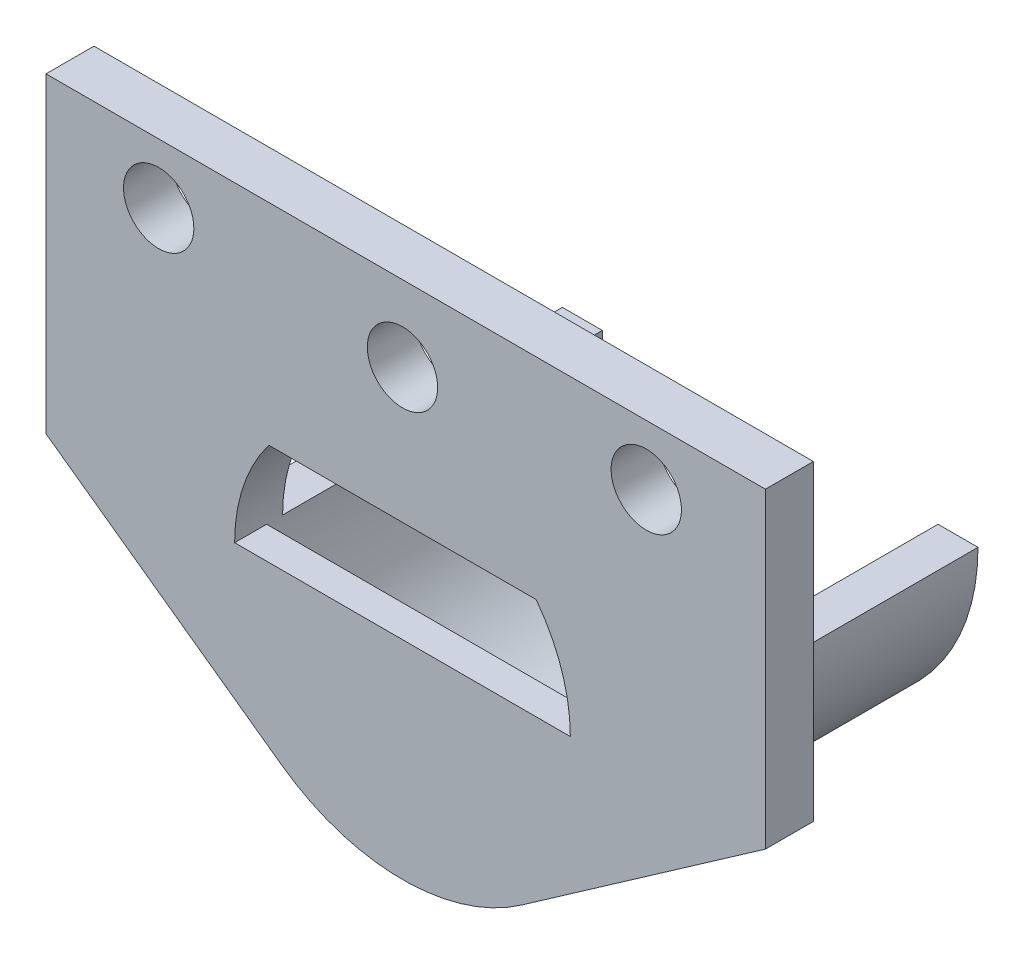
from build123d import *

# Parameters (mm, degrees)
SKETCH_2_R      = 10.5
SKETCH_2_R_2    = 2.2
EXTRUDE_1_DEPTH = 3
EXTRUDE_START   = -2
EXTRUDE_3_DEPTH = 2
EXTRUDE_START_2 = 20
EXTRUDE_5_DEPTH = 20


with BuildPart() as part:
    # 草图2 → 凸台-拉伸1 (new body)
    with BuildSketch(Plane.XY):
        with BuildLine():
            Line((8214.670798087, 3013.113410171), (8259.670798087, 3013.113410171))
            Line((8259.670798087, 3013.113410171), (8259.670798087, 2993.613410171))
            Line((8259.670798087, 2993.613410171), (8244.413270011, 2982.956276447))
            ThreePointArc((8244.413270011, 2982.956276447), (8236.88707696, 2980.614241973), (8229.391164024, 2983.051452794))
            Line((8229.391164024, 2983.051452794), (8214.670798087, 2993.613410171))
            Line((8214.670798087, 2993.613410171), (8214.670798087, 3013.113410171))
        make_face()
        with Locations((8236.969436473, 2993.613410171)):
            Circle(SKETCH_2_R, mode=Mode.SUBTRACT)
        with Locations((8236.969436473, 3008.366275847)):
            Circle(SKETCH_2_R_2, mode=Mode.SUBTRACT)
        with Locations((8221.719436473, 3009.366275847)):
            Circle(SKETCH_2_R_2, mode=Mode.SUBTRACT)
        with Locations((8252.219436473, 3009.366275847)):
            Circle(SKETCH_2_R_2, mode=Mode.SUBTRACT)
    extrude(amount=EXTRUDE_1_DEPTH)

    # 草图3 → 凸台-拉伸3 (add)
    with BuildSketch(Plane.XY.offset(3).offset(EXTRUDE_START)):
        with BuildLine():
            Line((8247.469436473, 2993.613410171), (8226.469436473, 2993.613410171))
            ThreePointArc((8226.469436473, 2993.613410171), (8236.969436473, 2983.113410171), (8247.469436473, 2993.613410171))
        make_face()
        with BuildLine():
            Line((8228.607869965, 2999.9643318), (8245.331002981, 2999.9643318))
            ThreePointArc((8245.331002981, 2999.9643318), (8236.969436473, 3004.113410171), (8228.607869965, 2999.9643318))
        make_face()
    extrude(amount=EXTRUDE_3_DEPTH)

    # 草图5 → 凸台-拉伸5 (add)
    with BuildSketch(Plane(origin=(0, 0, 0), x_dir=(-1, 0, 0), z_dir=(0, 0, -1)).offset(EXTRUDE_START_2)):
        with BuildLine():
            Line((-8247.469436473, 2993.613410171), (-8249.968865573, 2993.613410171))
            ThreePointArc((-8249.968865573, 2993.613410171), (-8236.969436473, 2980.61398107), (-8223.970007373, 2993.613410171))
            Line((-8223.970007373, 2993.613410171), (-8226.469436473, 2993.613410171))
            ThreePointArc((-8226.469436473, 2993.613410171), (-8236.969436473, 2983.113410171), (-8247.469436473, 2993.613410171))
        make_face()
    extrude(amount=-EXTRUDE_5_DEPTH)


solid = part.part
